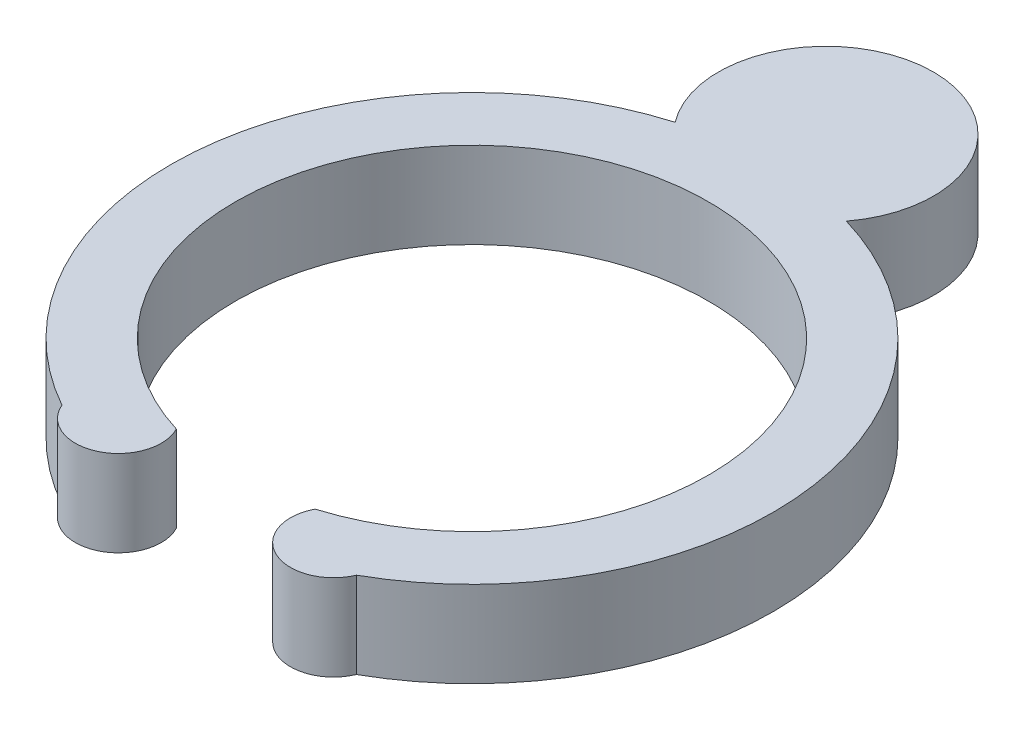
from build123d import *

# Parameters (mm, degrees)
SKETCH1_R           = 7
BOSS_EXTRUDE1_DEPTH = 2
SKETCH2_R           = 5.5
CUT_EXTRUDE1_DEPTH  = 2
SKETCH3_R           = 2.5
BOSS_EXTRUDE4_DEPTH = 2
SKETCH4_W           = 5
SKETCH4_H           = 5.341067824
CUT_EXTRUDE4_DEPTH  = 2
SKETCH6_R           = 1
BOSS_EXTRUDE6_DEPTH = 2
SKETCH8_R           = 1
BOSS_EXTRUDE7_DEPTH = 2
SKETCH9_R           = 5.5
CUT_EXTRUDE5_DEPTH  = 2


with BuildPart() as part:
    # Sketch1 → Boss-Extrude1 (new body)
    with BuildSketch(Plane(origin=(0, 0, 0), x_dir=(1, 0, 0), z_dir=(0, 1, 0))):
        with Locations(Location((0, 0, 0), (0, 0, 270))):
            Circle(SKETCH1_R)
    extrude(amount=BOSS_EXTRUDE1_DEPTH)

    # Sketch2 → Cut-Extrude1 (cut)
    with BuildSketch(Plane(origin=(0, 2, 0), x_dir=(1, 0, 0), z_dir=(0, 1, 0))):
        with Locations(Location((0, 0, 0), (0, 0, 270))):
            Circle(SKETCH2_R)
    extrude(amount=-CUT_EXTRUDE1_DEPTH, mode=Mode.SUBTRACT)

    # Sketch3 → Boss-Extrude4 (add)
    with BuildSketch(Plane.XZ):
        with Locations((0, -8.225966767)):
            Circle(SKETCH3_R)
    extrude(amount=-BOSS_EXTRUDE4_DEPTH)

    # Sketch4 → Cut-Extrude4 (cut)
    with BuildSketch(Plane(origin=(0, 2, 0), x_dir=(1, 0, 0), z_dir=(0, 1, 0))):
        with Locations((0, -7)):
            Rectangle(SKETCH4_W, SKETCH4_H)
    extrude(amount=-CUT_EXTRUDE4_DEPTH, mode=Mode.SUBTRACT)

    # Sketch6 → Boss-Extrude6 (add)
    with BuildSketch(Plane(origin=(0, 2, 0), x_dir=(1, 0, 0), z_dir=(0, 1, 0))):
        with Locations((2.5, -5.71866395)):
            Circle(SKETCH6_R)
    extrude(amount=-BOSS_EXTRUDE6_DEPTH)

    # Sketch8 → Boss-Extrude7 (add)
    with BuildSketch(Plane(origin=(0, 2, 0), x_dir=(1, 0, 0), z_dir=(0, 1, 0))):
        with Locations((-2.5, -5.71866395)):
            Circle(SKETCH8_R)
    extrude(amount=-BOSS_EXTRUDE7_DEPTH)

    # Sketch9 → Cut-Extrude5 (cut)
    with BuildSketch(Plane(origin=(0, 2, 0), x_dir=(1, 0, 0), z_dir=(0, 1, 0))):
        Circle(SKETCH9_R)
    extrude(amount=-CUT_EXTRUDE5_DEPTH, mode=Mode.SUBTRACT)


solid = part.part
